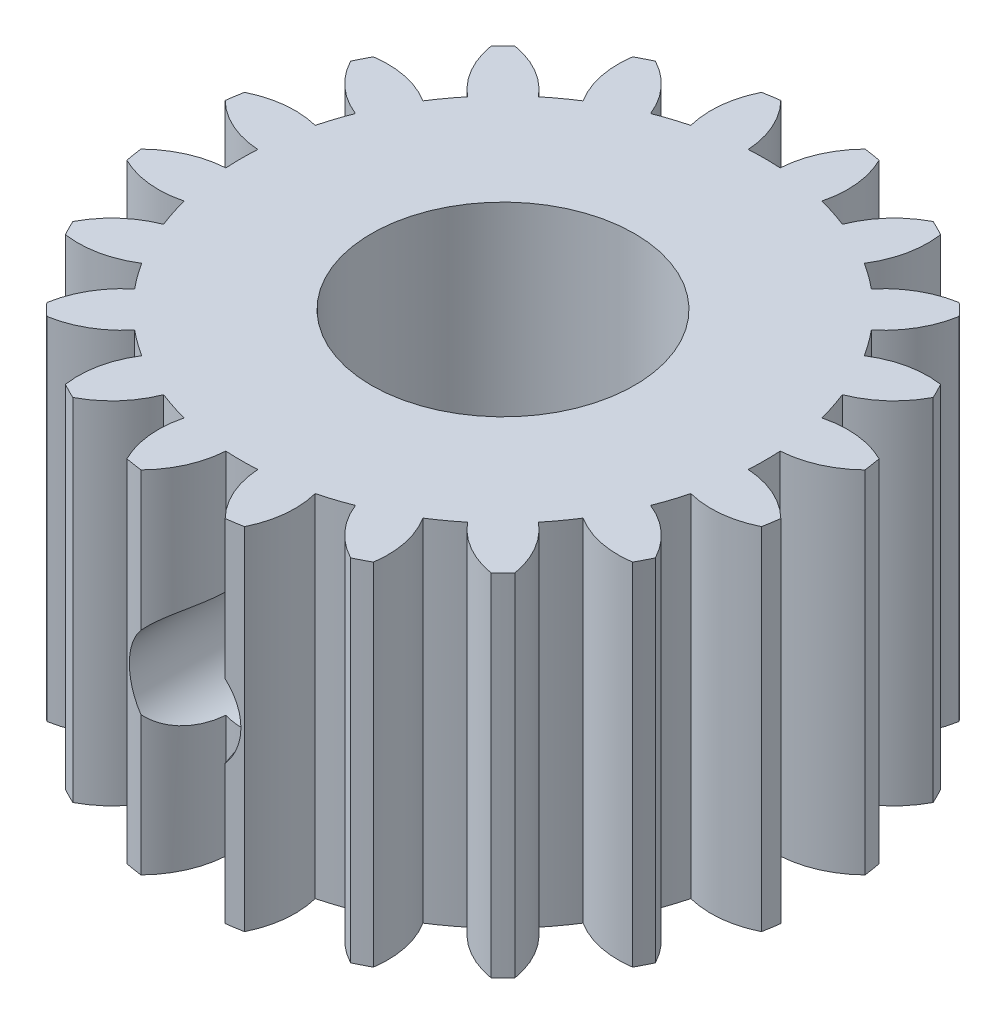
from build123d import *

# Parameters (mm, degrees)
SKETCH1_R                    = 11.684
BOSS_EXTRUDE1_DEPTH          = 12.7
F_3_8_0_375_DIAMETER_HOLE1_D = 9.525
CUT_EXTRUDE1_DEPTH           = 21.840386561
CIRPATTERN1_COUNT            = 20
F_10_32_TAPPED_HOLE2_REACH   = 30.849
F_10_32_TAPPED_HOLE2_BORE_R  = 2.0193


with BuildPart() as part:
    # Sketch1 → Boss-Extrude1 (new body)
    with BuildSketch(Plane(origin=(0, 0, 0), x_dir=(1, 0, 0), z_dir=(0, 1, 0))):
        with Locations(Location((0, 0, 0), (0, 0, 270))):
            Circle(SKETCH1_R)
    extrude(amount=BOSS_EXTRUDE1_DEPTH)

    # 3/8 (0.375) Diameter Hole1 (through all)
    with Locations(Plane(origin=(0, 12.7, 0), x_dir=(1, 0, 0), z_dir=(0, 1, 0))):
        with Locations((0, 0)):
            Hole(F_3_8_0_375_DIAMETER_HOLE1_D / 2)

    # Sketch6 → Cut-Extrude1 (cut, through all)
    with BuildSketch(Plane(origin=(0, 12.7, 0), x_dir=(1, 0, 0), z_dir=(0, 1, 0))):
        with BuildLine():
            ThreePointArc((-1.52506803, 11.58404176), (0, 11.684), (1.52506803, 11.58404176))
            ThreePointArc((1.52506803, 11.58404176), (0.859486594, 10.605826694), (0.578386073, 9.456528707))
            ThreePointArc((0.578386073, 9.456528707), (0, 9.4742), (-0.578386073, 9.456528707))
            ThreePointArc((-0.578386073, 9.456528707), (-0.859486594, 10.605826694), (-1.52506803, 11.58404176))
        make_face()
    cut_extrude1 = extrude(amount=-CUT_EXTRUDE1_DEPTH, mode=Mode.SUBTRACT)

    # CirPattern1: Cut-Extrude1 ×20 about axis
    cirpattern1_axis = Axis((0, 0, 0), (0, 1, 0))
    for i in range(1, CIRPATTERN1_COUNT):
        add(cut_extrude1.rotate(cirpattern1_axis, i * 360 / CIRPATTERN1_COUNT), mode=Mode.SUBTRACT)

    # #10-32 Tapped Hole2 bore → #10-32 Tapped Hole2 (cut, up to next)
    with BuildSketch(Plane.XY.offset(11.58404176), mode=Mode.PRIVATE) as f_10_32_tapped_hole2_sk1:
        with Locations((0, 6.35)):
            Circle(F_10_32_TAPPED_HOLE2_BORE_R)
    f_10_32_tapped_hole2_tool1 = extrude(f_10_32_tapped_hole2_sk1.sketch, amount=-F_10_32_TAPPED_HOLE2_REACH, mode=Mode.PRIVATE) & part.part
    add(f_10_32_tapped_hole2_tool1.solids().sort_by_distance((0, 6.35, 11.584042))[0], mode=Mode.SUBTRACT)


solid = part.part
